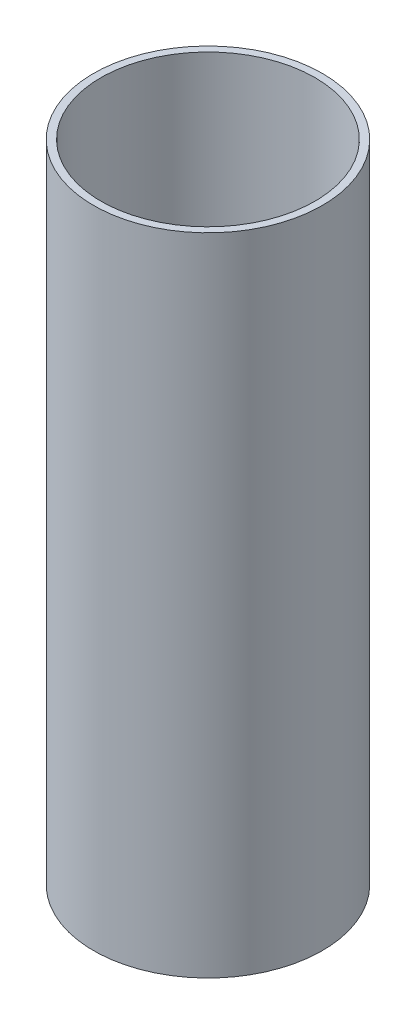
from build123d import *

# Parameters (mm, degrees)
SKETCH1_W = 3.175
SKETCH1_H = 279.4


with BuildPart() as part:
    # Sketch1 → Revolve1 (revolve)
    with BuildSketch(Plane.XY, mode=Mode.PRIVATE) as revolve1_sk:
        with Locations((47.9425, 139.7)):
            Rectangle(SKETCH1_W, SKETCH1_H)
    revolve(revolve1_sk.sketch.rotate(Axis((0, -13.97, 0), (0, 1, 0)), 90), axis=Axis((0, -13.97, 0), (0, 1, 0)))


solid = part.part
